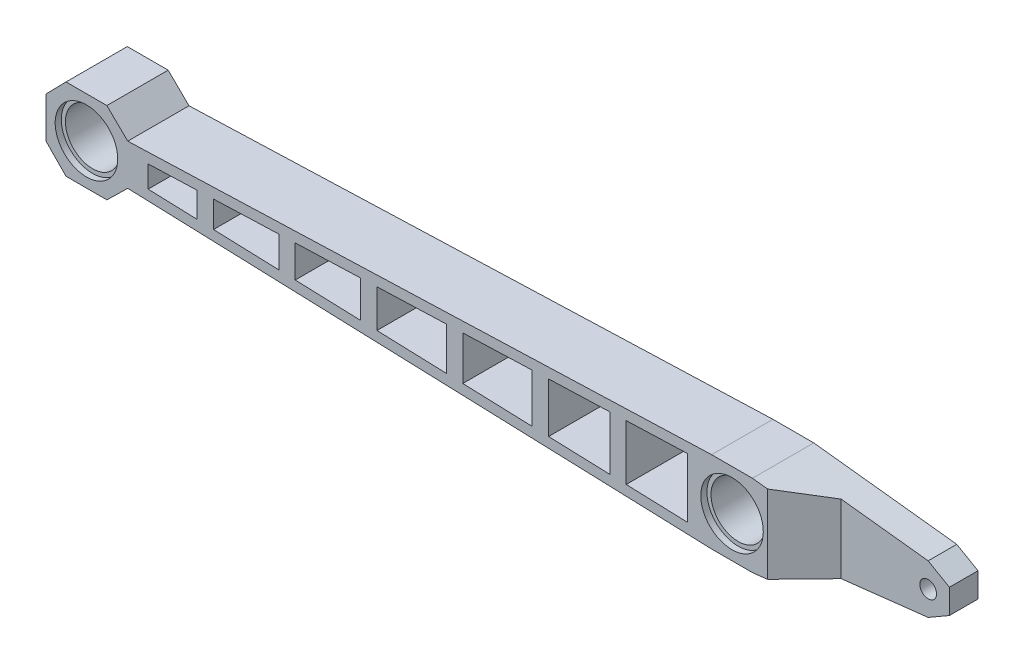
from build123d import *

# Parameters (mm, degrees)
SKETCH_1_R          = 6.65
SKETCH_1_R_2        = 2.05
EXTRUDE_1_DEPTH     = 15
CUT_EXTRUDE_1_DEPTH = 205.728298873
SKETCH_3_R          = 7.65
CUT_EXTRUDE_2_DEPTH = 1.5
CUT_EXTRUDE_START   = -1.5
SKETCH_4_R          = 7.65
CUT_EXTRUDE_3_DEPTH = 1.5


with BuildPart() as part:
    # 草图1 → 凸台-拉伸1 (new body)
    with BuildSketch(Plane.XY):
        Polygon((198, 6), (203.196152423, 3), (203.196152423, -3), (198, -6), (163, -10), (153, -10), (10.101020514, -5), (5, -10), (-5, -10), (-9.898979486, -5), (-9.898979486, 5), (-5, 10), (5, 10), (10.101020514, 5), (153, 10), (163, 10), align=None)
        Circle(SKETCH_1_R, mode=Mode.SUBTRACT)
        with Locations((198, 0)):
            Circle(SKETCH_1_R_2, mode=Mode.SUBTRACT)
        with Locations((158, 0)):
            Circle(SKETCH_1_R, mode=Mode.SUBTRACT)
        Polygon((15.101020514, -2.67341888), (15.101020514, 2.67341888), (27.101020514, 3.093295916), (27.101020514, -3.093295916), align=None, mode=Mode.SUBTRACT)
        Polygon((31.101020514, -3.233254928), (31.101020514, 3.233254928), (47.101020514, 3.793090977), (47.101020514, -3.793090977), align=None, mode=Mode.SUBTRACT)
        Polygon((51.101020514, -3.933049989), (51.101020514, 3.933049989), (67.101020514, 4.492886037), (67.101020514, -4.492886037), align=None, mode=Mode.SUBTRACT)
        Polygon((71.101020514, 4.632845049), (88.101020514, 5.227670851), (88.101020514, -5.227670851), (71.101020514, -4.632845049), align=None, mode=Mode.SUBTRACT)
        Polygon((109.101020514, 5.962455664), (109.101020514, -5.962455664), (92.101020514, -5.367629863), (92.101020514, 5.367629863), align=None, mode=Mode.SUBTRACT)
        Polygon((113.101020514, -6.102414676), (128.101020514, -6.627260972), (128.101020514, 6.627260972), (113.101020514, 6.102414676), align=None, mode=Mode.SUBTRACT)
        Polygon((147.101020514, -7.292066279), (147.101020514, 7.292066279), (132.101020514, 6.767219984), (132.101020514, -6.767219984), align=None, mode=Mode.SUBTRACT)
    extrude(amount=EXTRUDE_1_DEPTH)

    # 草图2 → 切除-拉伸1 (cut, through all)
    with BuildSketch(Plane.XZ.offset(10)):
        Polygon((166.7, 15), (176.696152423, 7), (203.196152423, 7), (203.196152423, 15), align=None)
    extrude(amount=-CUT_EXTRUDE_1_DEPTH, mode=Mode.SUBTRACT)

    # 草图3 → 切除-拉伸2 (cut)
    with BuildSketch(Plane.XY.offset(15)):
        Circle(SKETCH_3_R)
        with Locations((158, 0)):
            Circle(SKETCH_3_R)
    extrude(amount=-CUT_EXTRUDE_2_DEPTH, mode=Mode.SUBTRACT)

    # 草图4 → 切除-拉伸3 (cut)
    with BuildSketch(Plane(origin=(0, 0, 0), x_dir=(-1, 0, 0), z_dir=(0, 0, -1)).offset(CUT_EXTRUDE_START)):
        with Locations(Location((-158, 0, 0), (0, 0, 180))):
            Circle(SKETCH_4_R)
        with Locations(Location((0, 0, 0), (0, 0, 180))):
            Circle(SKETCH_4_R)
    extrude(amount=CUT_EXTRUDE_3_DEPTH, mode=Mode.SUBTRACT)


solid = part.part
